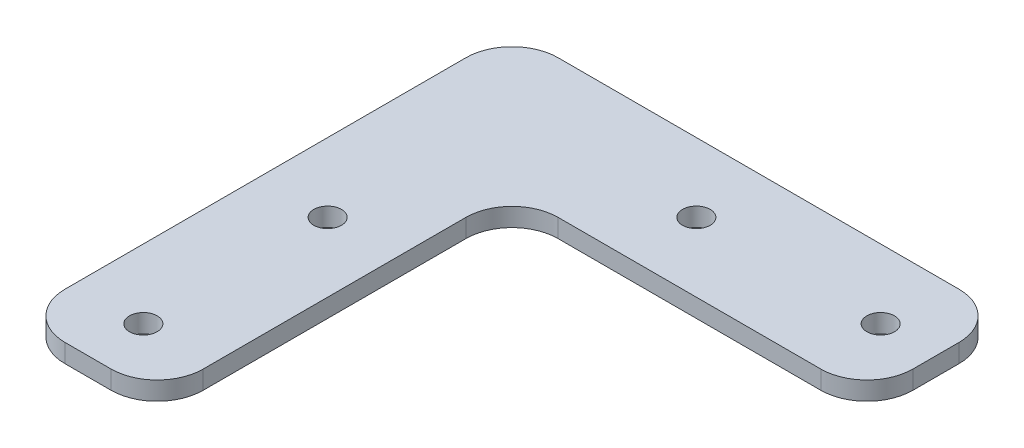
from build123d import *

# Parameters (mm, degrees)
SKETCH1_R           = 1.5
BOSS_EXTRUDE1_DEPTH = 2
FILLET1_R           = 5


with BuildPart() as part:
    # Sketch1 → Boss-Extrude1 (new body)
    with BuildSketch(Plane(origin=(0, 0, 0), x_dir=(1, 0, 0), z_dir=(0, 1, 0))):
        Polygon((7.5, -7.5), (7.5, -46), (-7.5, -46), (-7.5, 7.5), (46, 7.5), (46, -7.5), align=None)
        with Locations(Location((0, -40, 0), (0, 0, 270))):
            Circle(SKETCH1_R, mode=Mode.SUBTRACT)
        with Locations(Location((0, -20, 0), (0, 0, 270))):
            Circle(SKETCH1_R, mode=Mode.SUBTRACT)
        with Locations(Location((20, 0, 0), (0, 0, 90))):
            Circle(SKETCH1_R, mode=Mode.SUBTRACT)
        with Locations(Location((40, 0, 0), (0, 0, 90))):
            Circle(SKETCH1_R, mode=Mode.SUBTRACT)
    extrude(amount=BOSS_EXTRUDE1_DEPTH)

    # Fillet1
    fillet1_edges = [part.edges().sort_by_distance(p)[0] for p in [
        (7.5, 1, 7.5),
        (7.5, 1, 46),
        (-7.5, 1, 46),
        (-7.5, 1, -7.5),
        (46, 1, -7.5),
        (46, 1, 7.5),
    ]]
    fillet(fillet1_edges, radius=FILLET1_R)


solid = part.part
